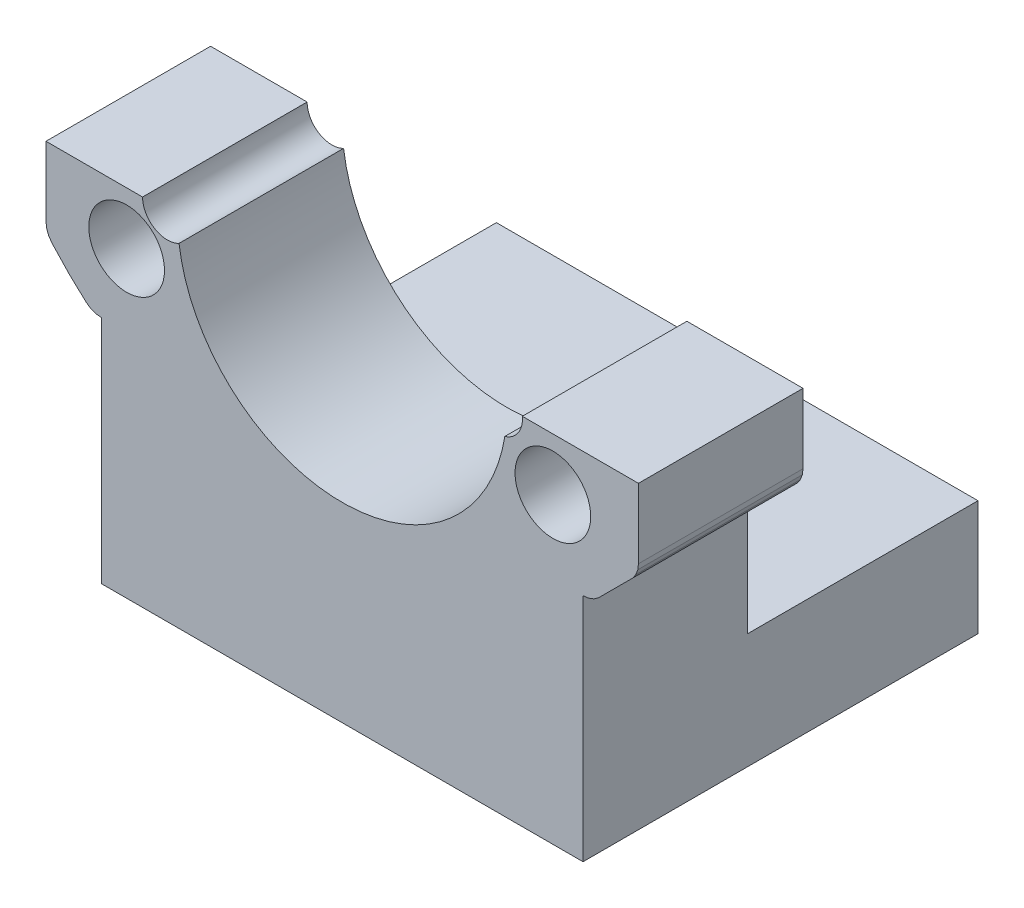
from build123d import *

# Parameters (mm, degrees)
FACE_2_DEPTH           = 5
SKETCH2_W              = 14.632926246
SKETCH2_H              = 5
BOSS_EXTRUDE2_DEPTH    = 7
SKETCH3_W              = 14.632926246
SKETCH3_H              = 7
BOSS_EXTRUDE3_DEPTH    = 7
EYE_HOLES_REACH        = 248.075
SKETCH4_R              = 1.15
SKETCH5_W              = 14.632926246
SKETCH5_H              = 3.5
SEAT_DEPTH             = 7
SKETCH6_W              = 18
SKETCH6_H              = 5
BOSS_EXTRUDE4_DEPTH    = 3.5
SKETCH7_W              = 18.025006546
SKETCH7_H              = 4.25
TOP_HOLE_DEPTH         = 248.972829901
MIDDLE_HOLE_DEPTH      = 246.672789516
MIDDLE_HOLE_DEPTH_BACK = 246.672789516
SKETCH8_R              = 5.003684601
SKETCH11_R             = 0.754398486
CUT_EXTRUDE9_DEPTH     = 246.672789516


with BuildPart() as part:
    # Sketch1 → Face 2 (new body)
    with BuildSketch(Plane.XY):
        Polygon((189.199131389, 129.336090234), (189.219408928, 129.168352428), (189.276625012, 129.01501095), (189.375109043, 128.870497126), (189.879763338, 128.333185306), (190.417075159, 127.828531011), (190.558185088, 127.731803407), (190.715733881, 127.672634267), (190.882668266, 127.652553357), (205.515594512, 127.652553357), (205.683332318, 127.672830896), (205.84007769, 127.731803407), (205.98118762, 127.828531011), (207.023153735, 128.870497126), (207.118523911, 129.009007135), (207.17885385, 129.168352428), (207.199131389, 129.336090234), (207.199131389, 132.202042434), (189.199131389, 132.202042434), align=None)
    extrude(amount=FACE_2_DEPTH)

    # Sketch2 → Boss-Extrude2 (add)
    with BuildSketch(Plane.XZ.offset(-127.652553357)):
        with Locations((198.199131389, 2.5)):
            Rectangle(SKETCH2_W, SKETCH2_H)
    extrude(amount=BOSS_EXTRUDE2_DEPTH)

    # Sketch3 → Boss-Extrude3 (add)
    with BuildSketch(Plane(origin=(0, 0, 0), x_dir=(-1, 0, 0), z_dir=(0, 0, -1))):
        with Locations((-198.199131389, 124.152553357)):
            Rectangle(SKETCH3_W, SKETCH3_H)
    extrude(amount=BOSS_EXTRUDE3_DEPTH)

    # Sketch4 → Eye Holes (cut, up to next)
    with BuildSketch(Plane.XY.offset(5), mode=Mode.PRIVATE) as eye_holes_sk1:
        with Locations((191.649131389, 129.852042434)):
            Circle(SKETCH4_R)
    eye_holes_tool1 = extrude(eye_holes_sk1.sketch, amount=-EYE_HOLES_REACH, mode=Mode.PRIVATE) & part.part
    # Sketch4 → Eye Holes (cut, up to next)
    with BuildSketch(Plane.XY.offset(5), mode=Mode.PRIVATE) as eye_holes_sk2:
        with Locations((204.599131389, 129.852042434)):
            Circle(SKETCH4_R)
    eye_holes_tool2 = extrude(eye_holes_sk2.sketch, amount=-EYE_HOLES_REACH, mode=Mode.PRIVATE) & part.part
    add(eye_holes_tool1.solids().sort_by_distance((191.649131, 129.852042, 5))[0], mode=Mode.SUBTRACT)
    add(eye_holes_tool2.solids().sort_by_distance((204.599131, 129.852042, 5))[0], mode=Mode.SUBTRACT)

    # Sketch5 → Seat (cut)
    with BuildSketch(Plane(origin=(0, 0, -7), x_dir=(-1, 0, 0), z_dir=(0, 0, -1))):
        with Locations((-198.199131389, 125.902553357)):
            Rectangle(SKETCH5_W, SKETCH5_H)
    extrude(amount=-SEAT_DEPTH, mode=Mode.SUBTRACT)

    # Sketch6 → Boss-Extrude4 (add)
    with BuildSketch(Plane(origin=(0, 132.202042434, 0), x_dir=(1, 0, 0), z_dir=(0, 1, 0))):
        with Locations((198.199131389, -2.5)):
            Rectangle(SKETCH6_W, SKETCH6_H)
    extrude(amount=BOSS_EXTRUDE4_DEPTH)

    # Sketch7 → Top Hole (cut, through all)
    with BuildSketch(Plane.XY.offset(5)):
        with Locations((198.194207579, 133.577042434)):
            Rectangle(SKETCH7_W, SKETCH7_H)
    extrude(amount=-TOP_HOLE_DEPTH, mode=Mode.SUBTRACT)

    # Sketch8 → Middle Hole (cut, two sides: drawn at the far end of the back side and taken through both)
    with BuildSketch(Plane.XY.offset(5).offset(-MIDDLE_HOLE_DEPTH_BACK)):
        with Locations((198.199131389, 131.452042434)):
            Circle(SKETCH8_R)
    extrude(amount=MIDDLE_HOLE_DEPTH + MIDDLE_HOLE_DEPTH_BACK, mode=Mode.SUBTRACT)

    # Sketch11 → Cut-Extrude9 (cut, through all)
    with BuildSketch(Plane.XY.offset(5)):
        with Locations((192.88691871, 131.452042434)):
            Circle(SKETCH11_R)
        with Locations((202.919958348, 131.377258625)):
            Circle(SKETCH11_R)
    extrude(amount=-CUT_EXTRUDE9_DEPTH, mode=Mode.SUBTRACT)


solid = part.part
